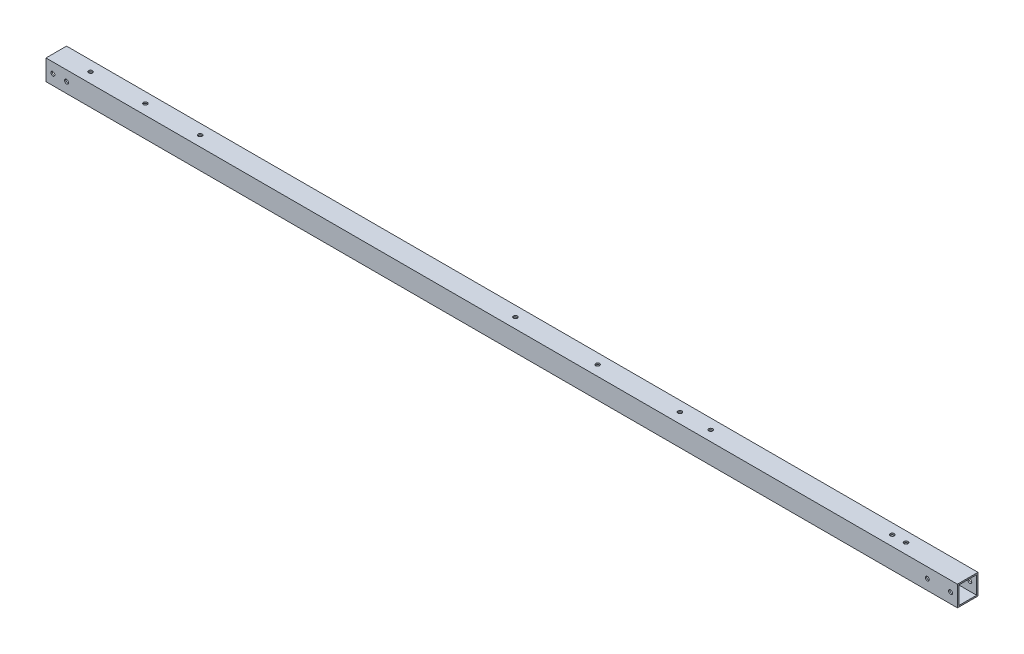
from build123d import *

# Parameters (mm, degrees)
SKETCH_1_W          = 15
SKETCH_1_H          = 15
SKETCH_1_W_2        = 13
SKETCH_1_H_2        = 13
EXTRUDE_1_DEPTH     = 665
SKETCH_2_R          = 1.45
CUT_EXTRUDE_1_DEPTH = 666.211432554
SKETCH_3_R          = 1.45
CUT_EXTRUDE_2_DEPTH = 666.211432554


with BuildPart() as part:
    # 草图1 → 凸台-拉伸1 (new body)
    with BuildSketch(Plane(origin=(0, 0, 0), x_dir=(0, 0, -1), z_dir=(1, 0, 0))):
        Rectangle(SKETCH_1_W, SKETCH_1_H)
        Rectangle(SKETCH_1_W_2, SKETCH_1_H_2, mode=Mode.SUBTRACT)
    extrude(amount=EXTRUDE_1_DEPTH)

    # 草图2 → 切除-拉伸1 (cut, through all)
    with BuildSketch(Plane(origin=(0, 7.5, 0), x_dir=(1, 0, 0), z_dir=(0, 1, 0))):
        with Locations(Location((610, 0, 0), (0, 0, 270))):
            Circle(SKETCH_2_R)
        with Locations(Location((477.5, 0, 0), (0, 0, 270))):
            Circle(SKETCH_2_R)
        with Locations(Location((455, 0, 0), (0, 0, 270))):
            Circle(SKETCH_2_R)
        with Locations(Location((395, 0, 0), (0, 0, 270))):
            Circle(SKETCH_2_R)
        with Locations(Location((335, 0, 0), (0, 0, 270))):
            Circle(SKETCH_2_R)
        with Locations(Location((105, 0, 0), (0, 0, 270))):
            Circle(SKETCH_2_R)
        with Locations(Location((65, 0, 0), (0, 0, 270))):
            Circle(SKETCH_2_R)
        with Locations(Location((25, 0, 0), (0, 0, 270))):
            Circle(SKETCH_2_R)
        with Locations(Location((620, 0, 0), (0, 0, 270))):
            Circle(SKETCH_2_R)
    extrude(amount=-CUT_EXTRUDE_1_DEPTH, mode=Mode.SUBTRACT)

    # 草图3 → 切除-拉伸2 (cut, through all)
    with BuildSketch(Plane.XY.offset(7.5)):
        with Locations((14.999999998, 0)):
            Circle(SKETCH_3_R)
        with Locations((4.999999998, 0)):
            Circle(SKETCH_3_R)
        with Locations((660, 0)):
            Circle(SKETCH_3_R)
        with Locations((643, 0)):
            Circle(SKETCH_3_R)
    extrude(amount=-CUT_EXTRUDE_2_DEPTH, mode=Mode.SUBTRACT)


solid = part.part
